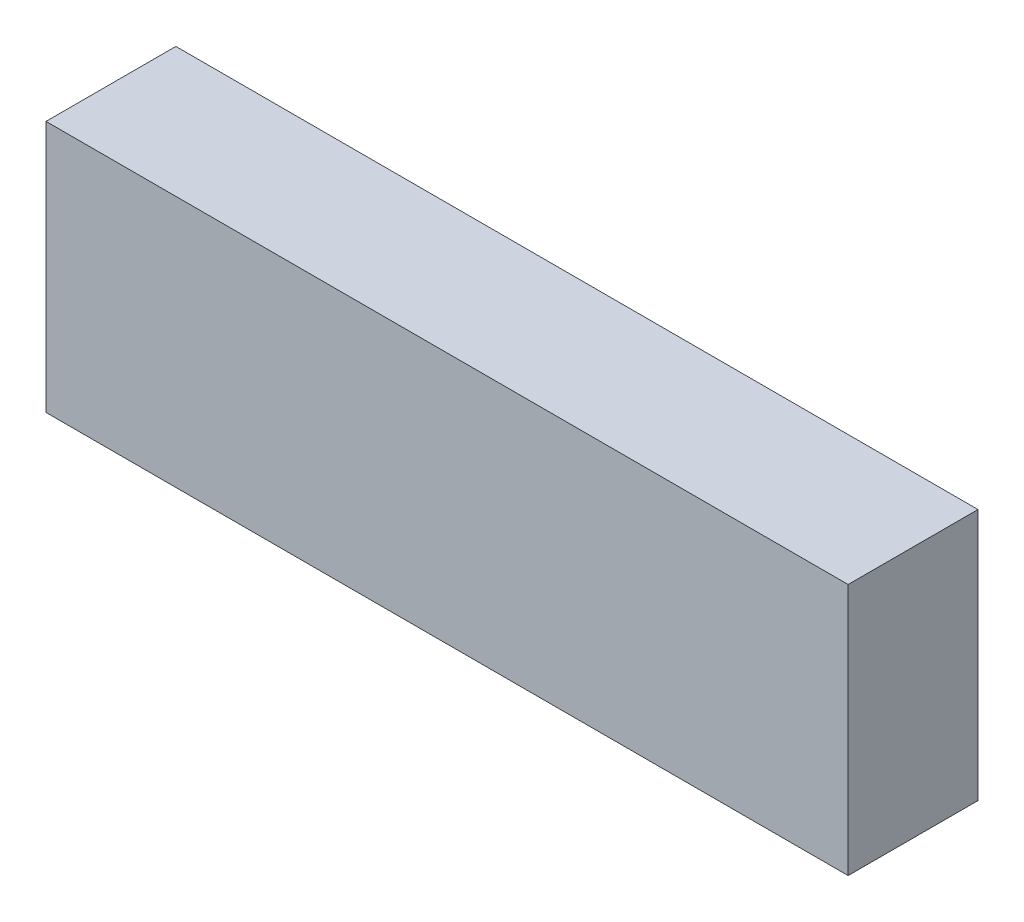
from build123d import *

# Parameters (mm, degrees)
SKETCH1_W           = 105
SKETCH1_H           = 33
BOSS_EXTRUDE1_DEPTH = 17


with BuildPart() as part:
    # Sketch1 → Boss-Extrude1 (new body)
    with BuildSketch(Plane.XY):
        Rectangle(SKETCH1_W, SKETCH1_H)
    extrude(amount=BOSS_EXTRUDE1_DEPTH)


solid = part.part
